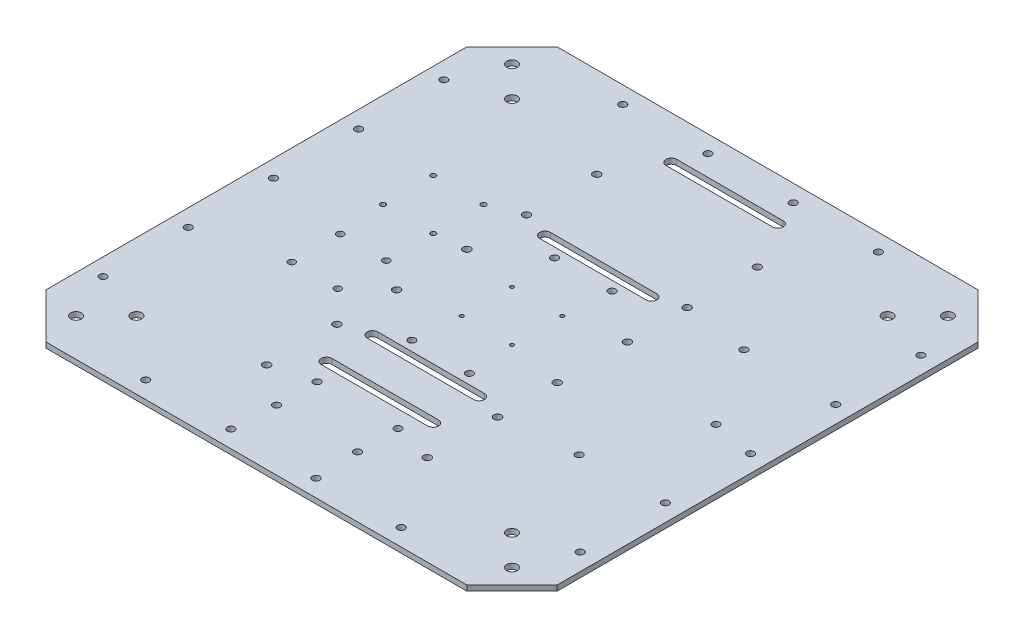
from build123d import *

# Parameters (mm, degrees)
BOSS_EXTRUDE1_DEPTH = 3.175
SKETCH2_R           = 2.159
CUT_EXTRUDE1_DEPTH  = 297.247830215
CUT_EXTRUDE2_DEPTH  = 297.247830215
SKETCH7_R           = 1.524
CUT_EXTRUDE3_DEPTH  = 297.247830215
SKETCH10_R          = 2.159
CUT_EXTRUDE6_DEPTH  = 297.247830215
SKETCH9_R           = 2.032
CUT_EXTRUDE5_DEPTH  = 297.247830215
SKETCH13_R          = 1.1
CUT_EXTRUDE8_DEPTH  = 297.247830215
SKETCH14_R          = 3.175
CUT_EXTRUDE9_DEPTH  = 297.247830215
SKETCH15_R          = 2.159
CUT_EXTRUDE10_DEPTH = 297.247830215
SKETCH16_R          = 2.159
CUT_EXTRUDE11_DEPTH = 297.247830215
SKETCH17_R          = 2.2225
CUT_EXTRUDE13_DEPTH = 297.247830215


with BuildPart() as part:
    # Sketch1 → Boss-Extrude1 (new body)
    with BuildSketch(Plane(origin=(0, 0, 0), x_dir=(1, 0, 0), z_dir=(0, 1, 0))):
        Polygon((-94.345284264, 72.258976948), (-121.286052627, 45.318208585), (-121.286052627, -205.600254688), (-94.345284264, -232.541023052), (156.573179009, -232.541023052), (183.513947373, -205.600254688), (183.513947373, 45.318208585), (156.573179009, 72.258976948), align=None)
    extrude(amount=BOSS_EXTRUDE1_DEPTH)

    # Sketch2 → Cut-Extrude1 (cut, through all)
    with BuildSketch(Plane(origin=(0, 3.175, 0), x_dir=(1, 0, 0), z_dir=(0, 1, 0))):
        with Locations(Location((13.841947373, -37.469023052, 0), (0, 0, 270))):
            Circle(SKETCH2_R)
        with Locations(Location((48.131947373, -37.469023052, 0), (0, 0, 270))):
            Circle(SKETCH2_R)
        with Locations(Location((13.841947373, -122.559023052, 0), (0, 0, 270))):
            Circle(SKETCH2_R)
        with Locations(Location((48.131947373, -122.559023052, 0), (0, 0, 270))):
            Circle(SKETCH2_R)
    extrude(amount=-CUT_EXTRUDE1_DEPTH, mode=Mode.SUBTRACT)

    # Sketch4 → Cut-Extrude2 (cut, through all)
    with BuildSketch(Plane(origin=(0, 3.175, 0), x_dir=(1, 0, 0), z_dir=(0, 1, 0))):
        with BuildLine():
            Line((-0.636052627, 49.818976948), (62.863947373, 49.818976948))
            ThreePointArc((62.863947373, 49.818976948), (66.038947373, 46.643976948), (62.863947373, 43.468976948))
            Line((62.863947373, 43.468976948), (-0.636052627, 43.468976948))
            ThreePointArc((-0.636052627, 43.468976948), (-3.811052627, 46.643976948), (-0.636052627, 49.818976948))
        make_face()
        with BuildLine():
            Line((-0.636052627, -25.531023052), (62.863947373, -25.531023052))
            ThreePointArc((62.863947373, -25.531023052), (66.038947373, -28.706023052), (62.863947373, -31.881023052))
            Line((62.863947373, -31.881023052), (-0.636052627, -31.881023052))
            ThreePointArc((-0.636052627, -31.881023052), (-3.811052627, -28.706023052), (-0.636052627, -25.531023052))
        make_face()
        with BuildLine():
            Line((-0.636052627, -128.401023052), (62.863947373, -128.401023052))
            ThreePointArc((62.863947373, -128.401023052), (66.038947373, -131.576023052), (62.863947373, -134.751023052))
            Line((62.863947373, -134.751023052), (-0.636052627, -134.751023052))
            ThreePointArc((-0.636052627, -134.751023052), (-3.811052627, -131.576023052), (-0.636052627, -128.401023052))
        make_face()
        with BuildLine():
            Line((-0.636052627, -155.751023052), (62.863947373, -155.751023052))
            ThreePointArc((62.863947373, -155.751023052), (66.038947373, -158.926023052), (62.863947373, -162.101023052))
            Line((62.863947373, -162.101023052), (-0.636052627, -162.101023052))
            ThreePointArc((-0.636052627, -162.101023052), (-3.811052627, -158.926023052), (-0.636052627, -155.751023052))
        make_face()
    extrude(amount=-CUT_EXTRUDE2_DEPTH, mode=Mode.SUBTRACT)

    # Sketch7 → Cut-Extrude3 (cut, through all)
    with BuildSketch(Plane(origin=(0, 3.175, 0), x_dir=(1, 0, 0), z_dir=(0, 1, 0))):
        with Locations(Location((-34.926052627, -31.119023052, 0), (0, 0, 270))):
            Circle(SKETCH7_R)
        with Locations(Location((-34.926052627, -61.091023052, 0), (0, 0, 270))):
            Circle(SKETCH7_R)
        with Locations(Location((-64.898052627, -61.091023052, 0), (0, 0, 90))):
            Circle(SKETCH7_R)
        with Locations(Location((-64.898052627, -31.119023052, 0), (0, 0, 90))):
            Circle(SKETCH7_R)
    extrude(amount=-CUT_EXTRUDE3_DEPTH, mode=Mode.SUBTRACT)

    # Sketch10 → Cut-Extrude6 (cut, through all)
    with BuildSketch(Plane.XZ):
        with Locations(Location((6.983947373, 196.391023052, 0), (0, 0, 270))):
            Circle(SKETCH10_R)
        with Locations(Location((55.243947373, 196.391023052, 0), (0, 0, 270))):
            Circle(SKETCH10_R)
        with Locations(Location((6.983947373, 172.261023052, 0), (0, 0, 270))):
            Circle(SKETCH10_R)
        with Locations(Location((55.243947373, 172.261023052, 0), (0, 0, 270))):
            Circle(SKETCH10_R)
    extrude(amount=-CUT_EXTRUDE6_DEPTH, mode=Mode.SUBTRACT)

    # Sketch9 → Cut-Extrude5 (cut, through all)
    with BuildSketch(Plane(origin=(0, 0, 0), x_dir=(-1, 0, 0), z_dir=(0, -1, 0))):
        with Locations(Location((62.358052627, -117.987023052, 0), (0, 0, 90))):
            Circle(SKETCH9_R)
        with Locations(Location((34.926052627, -117.987023052, 0), (0, 0, 270))):
            Circle(SKETCH9_R)
        with Locations(Location((62.358052627, -89.031023052, 0), (0, 0, 90))):
            Circle(SKETCH9_R)
        with Locations(Location((34.926052627, -89.031023052, 0), (0, 0, 270))):
            Circle(SKETCH9_R)
    extrude(amount=-CUT_EXTRUDE5_DEPTH, mode=Mode.SUBTRACT)

    # Sketch13 → Cut-Extrude8 (cut, through all)
    with BuildSketch(Plane.XZ):
        with Locations(Location((16.113947373, 95.141023052, 0), (0, 0, 270))):
            Circle(SKETCH13_R)
        with Locations(Location((16.113947373, 65.141023052, 0), (0, 0, 270))):
            Circle(SKETCH13_R)
        with Locations(Location((46.113947373, 65.141023052, 0), (0, 0, 90))):
            Circle(SKETCH13_R)
        with Locations(Location((46.113947373, 95.141023052, 0), (0, 0, 90))):
            Circle(SKETCH13_R)
    extrude(amount=-CUT_EXTRUDE8_DEPTH, mode=Mode.SUBTRACT)

    # Sketch14 → Cut-Extrude9 (cut, through all)
    with BuildSketch(Plane.XZ):
        with Locations(Location((-98.835412325, 210.090382749, 0), (0, 0, 270))):
            Circle(SKETCH14_R)
        with Locations(Location((-80.874900083, 192.129870507, 0), (0, 0, 270))):
            Circle(SKETCH14_R)
        with Locations(Location((143.102794828, 192.129870507, 0), (0, 0, 90))):
            Circle(SKETCH14_R)
        with Locations(Location((161.06330707, 210.090382749, 0), (0, 0, 90))):
            Circle(SKETCH14_R)
        with Locations(Location((-98.835412325, -49.808336646, 0), (0, 0, 90))):
            Circle(SKETCH14_R)
        with Locations(Location((-80.874900083, -31.847824404, 0), (0, 0, 90))):
            Circle(SKETCH14_R)
        with Locations(Location((161.06330707, -49.808336646, 0), (0, 0, 270))):
            Circle(SKETCH14_R)
        with Locations(Location((143.102794828, -31.847824404, 0), (0, 0, 270))):
            Circle(SKETCH14_R)
    extrude(amount=-CUT_EXTRUDE9_DEPTH, mode=Mode.SUBTRACT)

    # Sketch15 → Cut-Extrude10 (cut, through all)
    with BuildSketch(Plane.XZ):
        with Locations(Location((5.713947373, 222.381023052, 0), (0, 0, 270))):
            Circle(SKETCH15_R)
        with Locations(Location((-45.086052627, 222.381023052, 0), (0, 0, 270))):
            Circle(SKETCH15_R)
        with Locations(Location((-111.126052627, 80.141023052, 0), (0, 0, 270))):
            Circle(SKETCH15_R)
        with Locations(Location((-111.126052627, 130.941023052, 0), (0, 0, 270))):
            Circle(SKETCH15_R)
        with Locations(Location((-111.126052627, 181.741023052, 0), (0, 0, 270))):
            Circle(SKETCH15_R)
        with Locations(Location((173.353947373, 181.741023052, 0), (0, 0, 90))):
            Circle(SKETCH15_R)
        with Locations(Location((173.353947373, 130.941023052, 0), (0, 0, 90))):
            Circle(SKETCH15_R)
        with Locations(Location((173.353947373, 80.141023052, 0), (0, 0, 90))):
            Circle(SKETCH15_R)
        with Locations(Location((107.313947373, 222.381023052, 0), (0, 0, 90))):
            Circle(SKETCH15_R)
        with Locations(Location((56.513947373, 222.381023052, 0), (0, 0, 90))):
            Circle(SKETCH15_R)
        with Locations(Location((56.513947373, -62.098976948, 0), (0, 0, 270))):
            Circle(SKETCH15_R)
        with Locations(Location((107.313947373, -62.098976948, 0), (0, 0, 270))):
            Circle(SKETCH15_R)
        with Locations(Location((173.353947373, 29.341023052, 0), (0, 0, 270))):
            Circle(SKETCH15_R)
        with Locations(Location((173.353947373, -21.458976948, 0), (0, 0, 270))):
            Circle(SKETCH15_R)
        with Locations(Location((-111.126052627, -21.458976948, 0), (0, 0, 90))):
            Circle(SKETCH15_R)
        with Locations(Location((-111.126052627, 29.341023052, 0), (0, 0, 90))):
            Circle(SKETCH15_R)
        with Locations(Location((-45.086052627, -62.098976948, 0), (0, 0, 90))):
            Circle(SKETCH15_R)
        with Locations(Location((5.713947373, -62.098976948, 0), (0, 0, 90))):
            Circle(SKETCH15_R)
    extrude(amount=-CUT_EXTRUDE10_DEPTH, mode=Mode.SUBTRACT)

    # Sketch16 → Cut-Extrude11 (cut, through all)
    with BuildSketch(Plane(origin=(0, 0, 0), x_dir=(-1, 0, 0), z_dir=(0, -1, 0))):
        with Locations(Location((-122.807947373, -131.830023052, 0), (0, 0, 90))):
            Circle(SKETCH16_R)
        with Locations(Location((-117.727947373, -28.452023052, 0), (0, 0, 90))):
            Circle(SKETCH16_R)
        with Locations(Location((-147.953947373, -75.274023052, 0), (0, 0, 90))):
            Circle(SKETCH16_R)
    extrude(amount=-CUT_EXTRUDE11_DEPTH, mode=Mode.SUBTRACT)

    # Sketch17 → Cut-Extrude13 (cut, through all)
    with BuildSketch(Plane(origin=(0, 3.175, 0), x_dir=(1, 0, 0), z_dir=(0, 1, 0))):
        with Locations(Location((78.992947373, -178.566023052, 0), (0, 0, 270))):
            Circle(SKETCH17_R)
        with Locations(Location((-16.765052627, -178.566023052, 0), (0, 0, 270))):
            Circle(SKETCH17_R)
        with Locations(Location((78.992947373, -136.656023052, 0), (0, 0, 270))):
            Circle(SKETCH17_R)
        with Locations(Location((-16.765052627, -136.656023052, 0), (0, 0, 270))):
            Circle(SKETCH17_R)
        with Locations(Location((78.992947373, -101.096023052, 0), (0, 0, 270))):
            Circle(SKETCH17_R)
        with Locations(Location((-16.765052627, -101.096023052, 0), (0, 0, 270))):
            Circle(SKETCH17_R)
        with Locations(Location((78.992947373, -59.186023052, 0), (0, 0, 270))):
            Circle(SKETCH17_R)
        with Locations(Location((-16.765052627, -59.186023052, 0), (0, 0, 270))):
            Circle(SKETCH17_R)
        with Locations(Location((78.992947373, -23.626023052, 0), (0, 0, 270))):
            Circle(SKETCH17_R)
        with Locations(Location((-16.765052627, -23.626023052, 0), (0, 0, 270))):
            Circle(SKETCH17_R)
        with Locations(Location((78.992947373, 18.283976948, 0), (0, 0, 270))):
            Circle(SKETCH17_R)
        with Locations(Location((-16.765052627, 18.283976948, 0), (0, 0, 270))):
            Circle(SKETCH17_R)
    extrude(amount=-CUT_EXTRUDE13_DEPTH, mode=Mode.SUBTRACT)


solid = part.part
